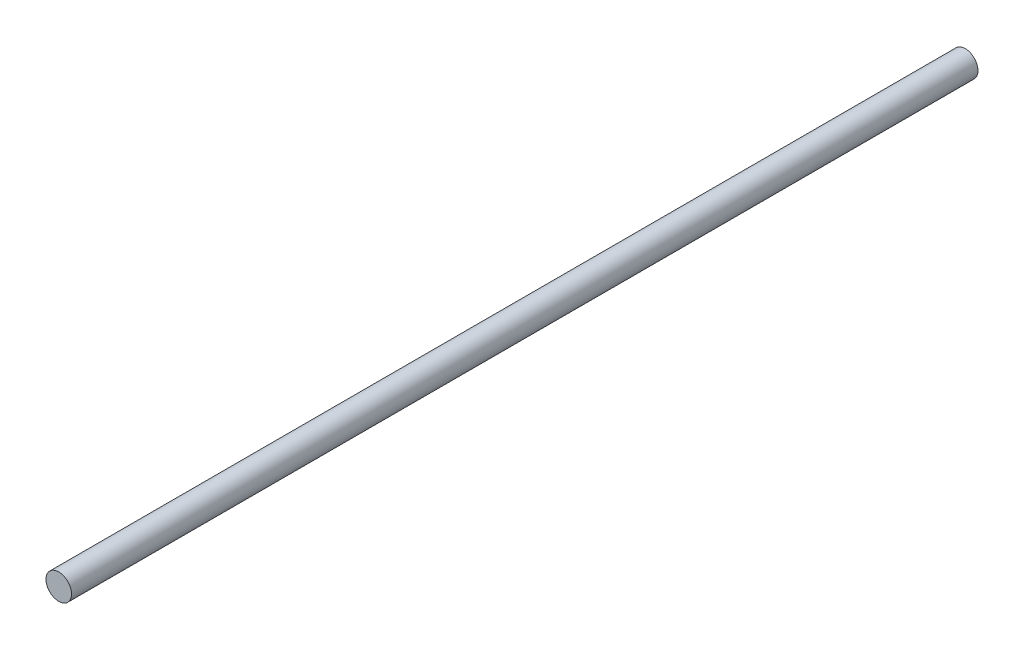
from build123d import *

# Parameters (mm, degrees)
SKETCH1_R           = 3.937
BOSS_EXTRUDE1_DEPTH = 279.4


with BuildPart() as part:
    # Sketch1 → Boss-Extrude1 (new body)
    with BuildSketch(Plane.XY):
        Circle(SKETCH1_R)
    extrude(amount=BOSS_EXTRUDE1_DEPTH)


solid = part.part
